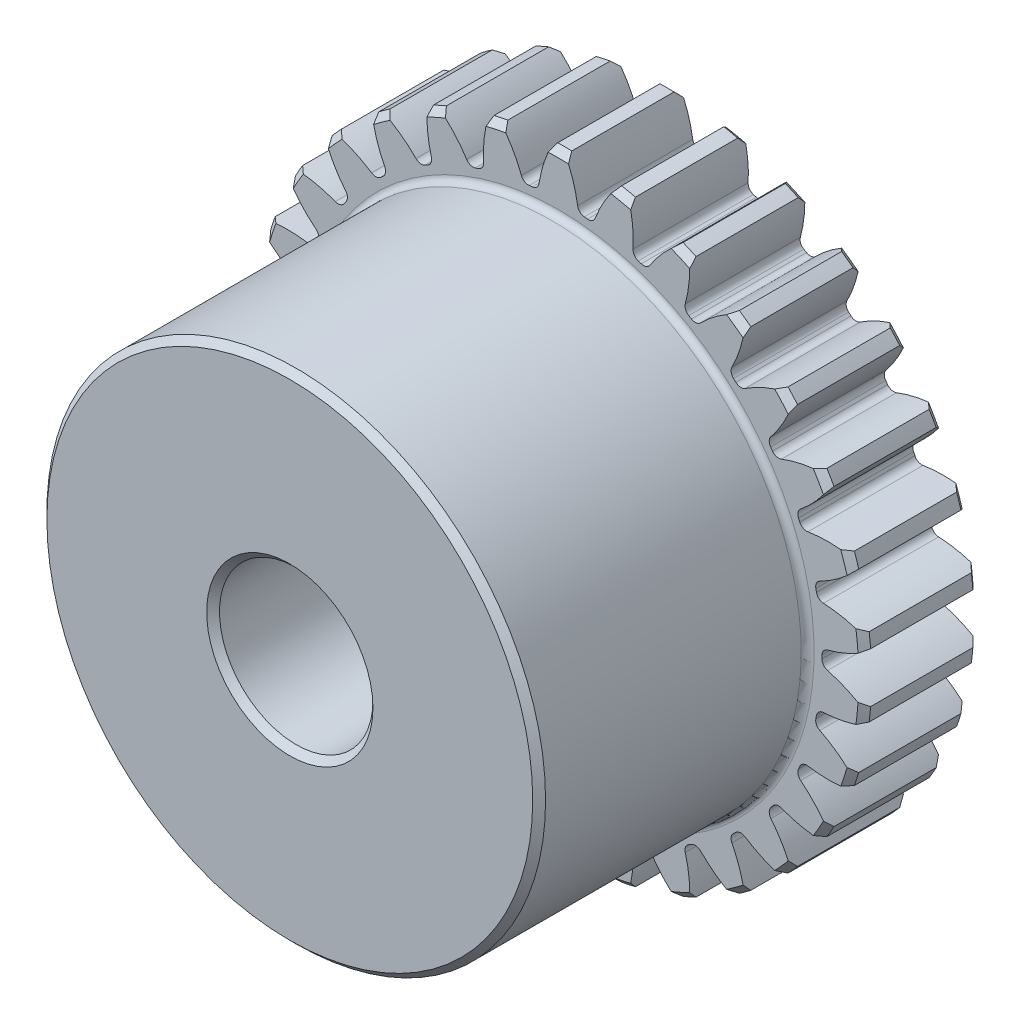
from build123d import *

# Parameters (mm, degrees)
BOSS_EXTRUDE1_DEPTH      = 7
BOSS_EXTRUDE1_DEPTH_BACK = 3
SKETCH3_R                = 8
SKETCH5_W                = 7
SKETCH5_H                = 1.5
SKETCH5_W_2              = 10
SKETCH5_H_2              = 2
FILLET2_R                = 0.167752518
CHAMFER1_SIZE            = 0.167752518
CUT_EXTRUDE1_DEPTH       = 14.304134696
FILLET1_R                = 0.196349541
CIRPATTERN1_COUNT        = 30
FILLET1_OF_CIRPATTERN1_R = 0.196349541


with BuildPart() as part:
    # Sketch3 → Boss-Extrude1 (new, two sides: drawn at the far end of the back side and taken through both)
    with BuildSketch(Plane.XY.offset(-BOSS_EXTRUDE1_DEPTH_BACK)):
        Circle(SKETCH3_R)
    extrude(amount=BOSS_EXTRUDE1_DEPTH + BOSS_EXTRUDE1_DEPTH_BACK)

    # Sketch5 → Cut-Revolve1 (revolve, cut)
    with BuildSketch(Plane(origin=(0, 0, 0), x_dir=(0, 0, -1), z_dir=(1, 0, 0)), mode=Mode.PRIVATE) as cut_revolve1_sk:
        with Locations((-3.5, 7.25)):
            Rectangle(SKETCH5_W, SKETCH5_H)
        with Locations((-2, 1)):
            Rectangle(SKETCH5_W_2, SKETCH5_H_2)
    revolve(cut_revolve1_sk.sketch.rotate(Axis((0, 0, 7), (0, 0, -1)), 180), axis=Axis((0, 0, 7), (0, 0, -1)), mode=Mode.SUBTRACT)

    # Fillet2
    fillet2_edges = [part.edges().sort_by_distance(p)[0] for p in [
        (0, 6.5, 0),
    ]]
    fillet(fillet2_edges, radius=FILLET2_R)

    # Chamfer1
    chamfer1_edges = [part.edges().sort_by_distance(p)[0] for p in [
        (0, 2, 7),
        (0, 2, -3),
        (-8, 0, 0),
        (0, 6.5, 7),
        (-8, 0, -3),
    ]]
    chamfer(chamfer1_edges, length=CHAMFER1_SIZE)

    # Sketch4 → Cut-Extrude1 (cut, symmetric)
    with BuildSketch(Plane.XY):
        with BuildLine():
            Line((6.872195563, 0.196349541), (6.872195563, -0.196349541))
            ThreePointArc((6.872195563, -0.196349541), (7.443550085, -0.374356807), (7.973330951, -0.652681816))
            ThreePointArc((7.973330951, -0.652681816), (8, 0), (7.973330951, 0.652681816))
            ThreePointArc((7.973330951, 0.652681816), (7.443550085, 0.374356807), (6.872195563, 0.196349541))
        make_face()
    cut_extrude1 = extrude(amount=CUT_EXTRUDE1_DEPTH, both=True, mode=Mode.SUBTRACT)

    # Fillet1
    fillet1_edges = [part.edges().sort_by_distance(p)[0] for p in [
        (6.872195563, 0.196349541, -1.5),
        (6.872195563, -0.196349541, -1.5),
    ]]
    fillet(fillet1_edges, radius=FILLET1_R)

    # CirPattern1: Cut-Extrude1 ×30 about axis
    cirpattern1_axis = Axis((0, 0, 0), (0, 0, 1))
    for i in range(1, CIRPATTERN1_COUNT):
        add(cut_extrude1.rotate(cirpattern1_axis, i * 360 / CIRPATTERN1_COUNT), mode=Mode.SUBTRACT)

    # Fillet1 of CirPattern1
    fillet1_of_cirpattern1_edges = [part.edges().sort_by_distance(p)[0] for p in [
        (6.681198237, 1.620868631, -1.5),
        (6.762844967, 1.236750967, -1.5),
        (6.198200488, 2.974547985, -1.5),
        (6.357925594, 2.615799523, -1.5),
        (5.444311635, 4.198225318, -1.5),
        (5.675134364, 3.880525087, -1.5),
        (4.452480239, 5.23842006, -1.5),
        (4.744312529, 4.975653085, -1.5),
        (3.266054091, 6.049670708, -1.5),
        (3.606141472, 5.853321167, -1.5),
        (1.936885707, 6.596521717, -1.5),
        (2.310364728, 6.475171027, -1.5),
        (0.523066124, 6.855073073, -1.5),
        (0.913613959, 6.814024841, -1.5),
        (-0.913613959, 6.814024841, -1.5),
        (-0.523066124, 6.855073073, -1.5),
        (-2.310364728, 6.475171027, -1.5),
        (-1.936885707, 6.596521717, -1.5),
        (-3.606141472, 5.853321167, -1.5),
        (-3.266054091, 6.049670708, -1.5),
        (-4.744312529, 4.975653085, -1.5),
        (-4.452480239, 5.23842006, -1.5),
        (-5.675134364, 3.880525087, -1.5),
        (-5.444311635, 4.198225318, -1.5),
        (-6.357925594, 2.615799523, -1.5),
        (-6.198200488, 2.974547985, -1.5),
        (-6.762844967, 1.236750967, -1.5),
        (-6.681198237, 1.620868631, -1.5),
        (-6.872195563, -0.196349541, -1.5),
        (-6.872195563, 0.196349541, -1.5),
        (-6.681198237, -1.620868631, -1.5),
        (-6.762844967, -1.236750967, -1.5),
        (-6.198200488, -2.974547985, -1.5),
        (-6.357925594, -2.615799523, -1.5),
        (-5.444311635, -4.198225318, -1.5),
        (-5.675134364, -3.880525087, -1.5),
        (-4.452480239, -5.23842006, -1.5),
        (-4.744312529, -4.975653085, -1.5),
        (-3.266054091, -6.049670708, -1.5),
        (-3.606141472, -5.853321167, -1.5),
        (-1.936885707, -6.596521717, -1.5),
        (-2.310364728, -6.475171027, -1.5),
        (-0.523066124, -6.855073073, -1.5),
        (-0.913613959, -6.814024841, -1.5),
        (0.913613959, -6.814024841, -1.5),
        (0.523066124, -6.855073073, -1.5),
        (2.310364728, -6.475171027, -1.5),
        (1.936885707, -6.596521717, -1.5),
        (3.606141472, -5.853321167, -1.5),
        (3.266054091, -6.049670708, -1.5),
        (4.744312529, -4.975653085, -1.5),
        (4.452480239, -5.23842006, -1.5),
        (5.675134364, -3.880525087, -1.5),
        (5.444311635, -4.198225318, -1.5),
        (6.357925594, -2.615799523, -1.5),
        (6.198200488, -2.974547985, -1.5),
        (6.762844967, -1.236750967, -1.5),
        (6.681198237, -1.620868631, -1.5),
    ]]
    fillet(fillet1_of_cirpattern1_edges, radius=FILLET1_OF_CIRPATTERN1_R)


solid = part.part
